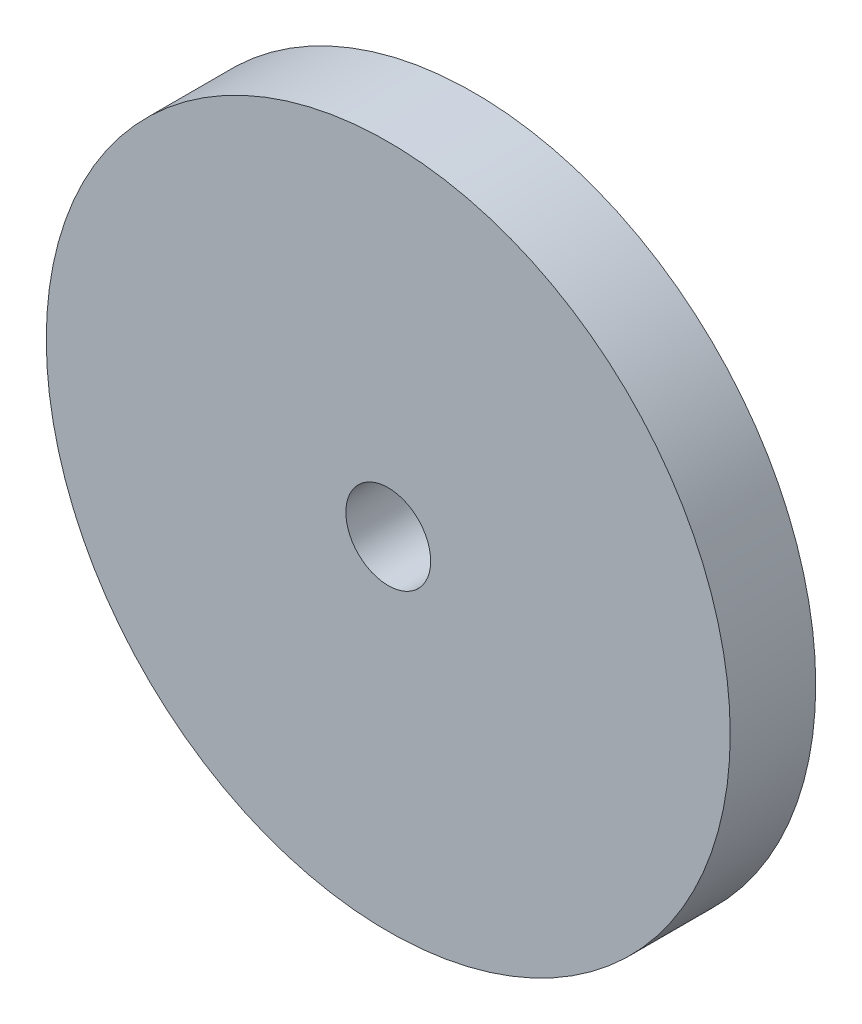
from build123d import *

# Parameters (mm, degrees)
SKETCH1_R           = 25.4
SKETCH1_R_2         = 3.1496
BOSS_EXTRUDE1_DEPTH = 6.35


with BuildPart() as part:
    # Sketch1 → Boss-Extrude1 (new body)
    with BuildSketch(Plane.XY):
        Circle(SKETCH1_R)
        Circle(SKETCH1_R_2, mode=Mode.SUBTRACT)
    extrude(amount=BOSS_EXTRUDE1_DEPTH)


solid = part.part
